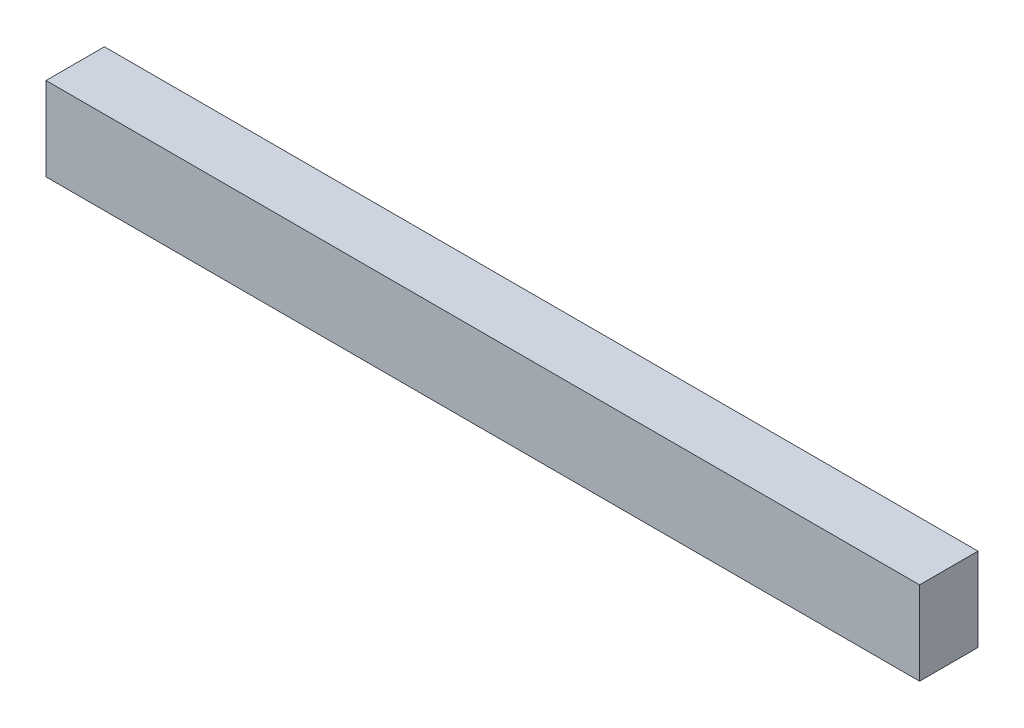
from build123d import *

# Parameters (mm, degrees)
SKETCH_1_W      = 314
SKETCH_1_H      = 30
EXTRUDE_1_DEPTH = 21


with BuildPart() as part:
    # 草图1 → 凸台-拉伸1 (new body)
    with BuildSketch(Plane.XY):
        with Locations((139.324182989, 8.338012959)):
            Rectangle(SKETCH_1_W, SKETCH_1_H)
    extrude(amount=EXTRUDE_1_DEPTH)


solid = part.part
